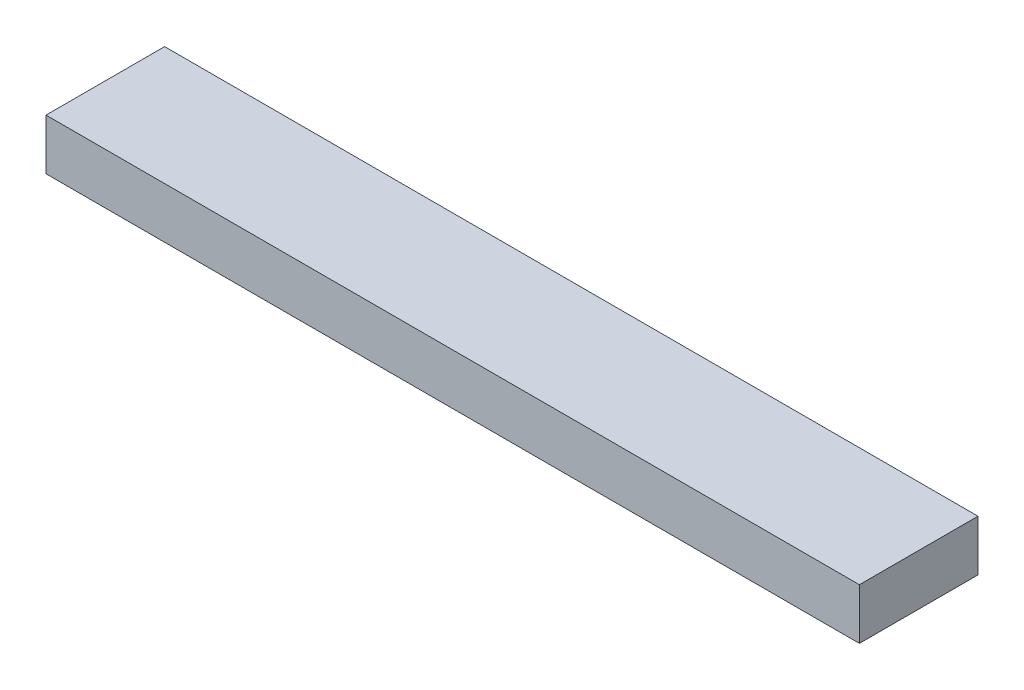
from build123d import *

# Parameters (mm, degrees)
SKETCH1_W           = 38.1
SKETCH1_H           = 88.9
BOSS_EXTRUDE1_DEPTH = 609.6


with BuildPart() as part:
    # Sketch1 → Boss-Extrude1 (new body)
    with BuildSketch(Plane(origin=(0, 0, 0), x_dir=(0, -1, 0), z_dir=(1, 0, 0))):
        Rectangle(SKETCH1_W, SKETCH1_H)
    extrude(amount=BOSS_EXTRUDE1_DEPTH)


solid = part.part
